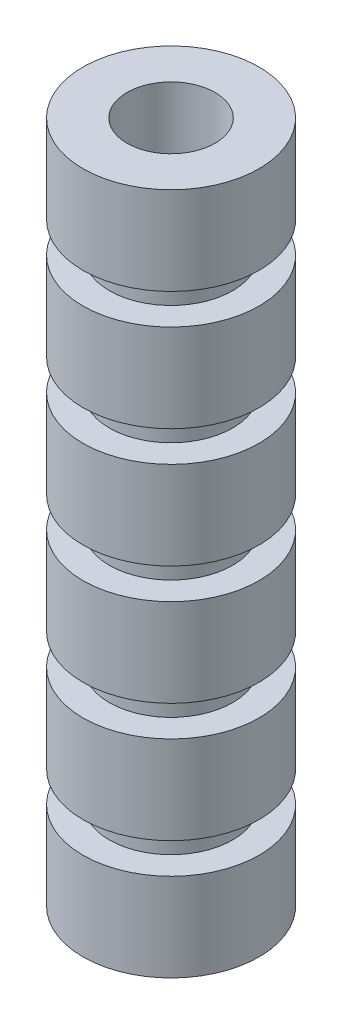
from build123d import *

# Parameters (mm, degrees)
SKETCH1_R            = 10
SKETCH1_R_2          = 5
BOSS_EXTRUDE1_DEPTH  = 10
SKETCH2_R            = 7
SKETCH2_R_2          = 5
BOSS_EXTRUDE2_DEPTH  = 3.5
SKETCH3_R            = 10
SKETCH3_R_2          = 5
BOSS_EXTRUDE3_DEPTH  = 10
SKETCH4_R            = 7
SKETCH4_R_2          = 5
BOSS_EXTRUDE4_DEPTH  = 3.5
SKETCH5_R            = 10
SKETCH5_R_2          = 5
BOSS_EXTRUDE5_DEPTH  = 10
SKETCH6_R            = 7
SKETCH6_R_2          = 5
BOSS_EXTRUDE6_DEPTH  = 3.5
SKETCH7_R            = 10
SKETCH7_R_2          = 5
BOSS_EXTRUDE7_DEPTH  = 10
SKETCH8_R            = 7
SKETCH8_R_2          = 5
BOSS_EXTRUDE8_DEPTH  = 3.5
SKETCH9_R            = 10
SKETCH9_R_2          = 5
BOSS_EXTRUDE9_DEPTH  = 10
SKETCH10_R           = 7
SKETCH10_R_2         = 5
BOSS_EXTRUDE10_DEPTH = 3.5
SKETCH11_R           = 10
SKETCH11_R_2         = 5
BOSS_EXTRUDE11_DEPTH = 10


with BuildPart() as part:
    # Sketch1 → Boss-Extrude1 (new body)
    with BuildSketch(Plane(origin=(0, 0, 0), x_dir=(1, 0, 0), z_dir=(0, 1, 0))):
        Circle(SKETCH1_R)
        Circle(SKETCH1_R_2, mode=Mode.SUBTRACT)
    extrude(amount=BOSS_EXTRUDE1_DEPTH)

    # Sketch2 → Boss-Extrude2 (add)
    with BuildSketch(Plane(origin=(0, 10, 0), x_dir=(1, 0, 0), z_dir=(0, 1, 0))):
        Circle(SKETCH2_R)
        Circle(SKETCH2_R_2, mode=Mode.SUBTRACT)
    extrude(amount=BOSS_EXTRUDE2_DEPTH)

    # Sketch3 → Boss-Extrude3 (add)
    with BuildSketch(Plane(origin=(0, 13.5, 0), x_dir=(1, 0, 0), z_dir=(0, 1, 0))):
        Circle(SKETCH3_R)
        Circle(SKETCH3_R_2, mode=Mode.SUBTRACT)
    extrude(amount=BOSS_EXTRUDE3_DEPTH)

    # Sketch4 → Boss-Extrude4 (add)
    with BuildSketch(Plane(origin=(0, 23.5, 0), x_dir=(1, 0, 0), z_dir=(0, 1, 0))):
        Circle(SKETCH4_R)
        Circle(SKETCH4_R_2, mode=Mode.SUBTRACT)
    extrude(amount=BOSS_EXTRUDE4_DEPTH)

    # Sketch5 → Boss-Extrude5 (add)
    with BuildSketch(Plane(origin=(0, 27, 0), x_dir=(1, 0, 0), z_dir=(0, 1, 0))):
        Circle(SKETCH5_R)
        Circle(SKETCH5_R_2, mode=Mode.SUBTRACT)
    extrude(amount=BOSS_EXTRUDE5_DEPTH)

    # Sketch6 → Boss-Extrude6 (add)
    with BuildSketch(Plane(origin=(0, 37, 0), x_dir=(1, 0, 0), z_dir=(0, 1, 0))):
        Circle(SKETCH6_R)
        Circle(SKETCH6_R_2, mode=Mode.SUBTRACT)
    extrude(amount=BOSS_EXTRUDE6_DEPTH)

    # Sketch7 → Boss-Extrude7 (add)
    with BuildSketch(Plane(origin=(0, 40.5, 0), x_dir=(1, 0, 0), z_dir=(0, 1, 0))):
        Circle(SKETCH7_R)
        Circle(SKETCH7_R_2, mode=Mode.SUBTRACT)
    extrude(amount=BOSS_EXTRUDE7_DEPTH)

    # Sketch8 → Boss-Extrude8 (add)
    with BuildSketch(Plane(origin=(0, 50.5, 0), x_dir=(1, 0, 0), z_dir=(0, 1, 0))):
        Circle(SKETCH8_R)
        Circle(SKETCH8_R_2, mode=Mode.SUBTRACT)
    extrude(amount=BOSS_EXTRUDE8_DEPTH)

    # Sketch9 → Boss-Extrude9 (add)
    with BuildSketch(Plane(origin=(0, 54, 0), x_dir=(1, 0, 0), z_dir=(0, 1, 0))):
        Circle(SKETCH9_R)
        Circle(SKETCH9_R_2, mode=Mode.SUBTRACT)
    extrude(amount=BOSS_EXTRUDE9_DEPTH)

    # Sketch10 → Boss-Extrude10 (add)
    with BuildSketch(Plane(origin=(0, 64, 0), x_dir=(1, 0, 0), z_dir=(0, 1, 0))):
        Circle(SKETCH10_R)
        Circle(SKETCH10_R_2, mode=Mode.SUBTRACT)
    extrude(amount=BOSS_EXTRUDE10_DEPTH)

    # Sketch11 → Boss-Extrude11 (add)
    with BuildSketch(Plane(origin=(0, 67.5, 0), x_dir=(1, 0, 0), z_dir=(0, 1, 0))):
        Circle(SKETCH11_R)
        Circle(SKETCH11_R_2, mode=Mode.SUBTRACT)
    extrude(amount=BOSS_EXTRUDE11_DEPTH)


solid = part.part
